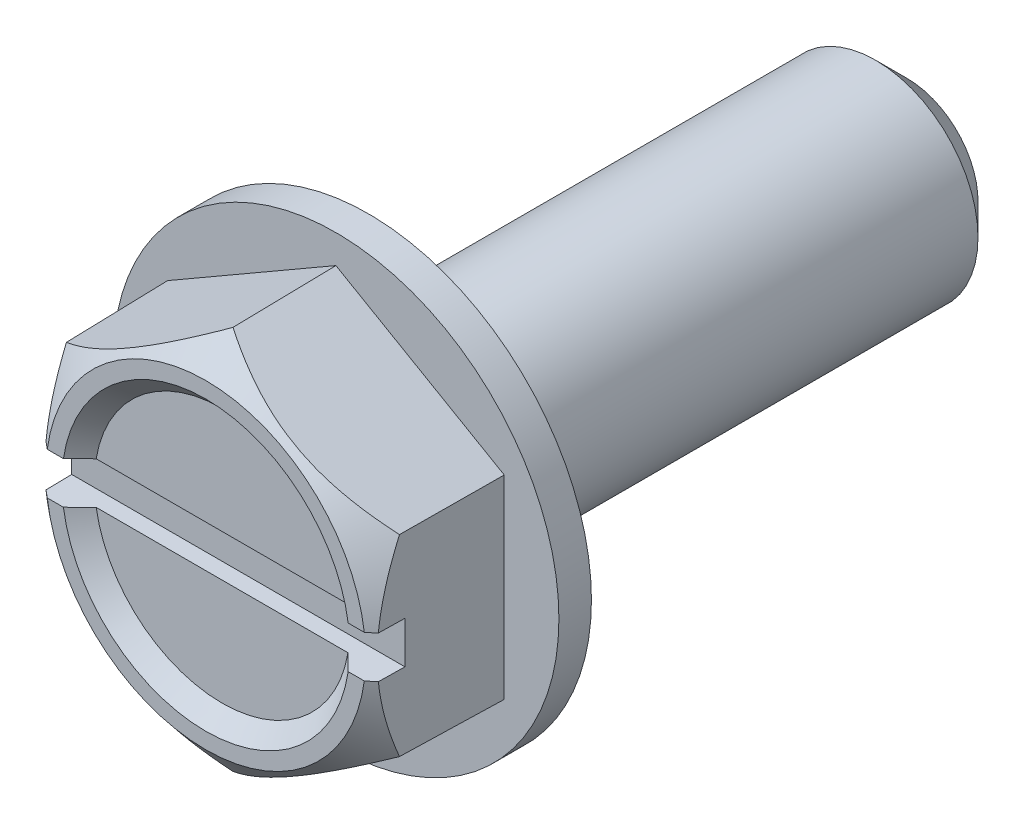
from build123d import *

# Parameters (mm, degrees)
SKETCH3_R           = 5.2578
BOSS_EXTRUDE1_DEPTH = 0.76708
BOSS_EXTRUDE2_DEPTH = 3.06832
BOSS_EXTRUDE2_TAPER = 1
SKETCH5_OUTSIDE_W   = 62.562
SKETCH5_OUTSIDE_H   = 62.562
SKETCH5_OUTSIDE_R   = 3.7703125
CUT_EXTRUDE1_DEPTH  = 19.130316457
CUT_EXTRUDE1_DRAFT  = -50
SKETCH6_R           = 3.39328125
CUT_EXTRUDE2_DEPTH  = 0.38354
CUT_EXTRUDE2_DRAFT  = -45
CUT_EXTRUDE3_START  = 3.8354
SKETCH10_W          = 8.334375
SKETCH10_H          = 0.9921875
CUT_EXTRUDE3_DEPTH  = 0.76708


with BuildPart() as part:
    # Sketch2 → Revolve1 (revolve)
    with BuildSketch(Plane(origin=(0, 0, 0), x_dir=(0, 0, -1), z_dir=(1, 0, 0))):
        Polygon((0, 0), (0, 2.413), (11.959166667, 2.413), (12.7, 1.672166667), (12.7, 0), align=None)
    revolve(axis=Axis((0, 0, -12.7), (0, 0, 1)))

    # Sketch3 → Boss-Extrude1 (add)
    with BuildSketch(Plane.XY):
        Circle(SKETCH3_R)
    extrude(amount=BOSS_EXTRUDE1_DEPTH)

    # Sketch4 → Boss-Extrude2 (add)
    with BuildSketch(Plane.XY.offset(0.76708)):
        Polygon((-3.96875, 2.291358881), (-3.96875, -2.291358881), (0, -4.582717762), (3.96875, -2.291358881), (3.96875, 2.291358881), (0, 4.582717762), align=None)
    extrude(amount=BOSS_EXTRUDE2_DEPTH, taper=BOSS_EXTRUDE2_TAPER)


with BuildPart() as cut_extrude1_tool:
    # Sketch5 outside → Cut-Extrude1 (with draft: the straight prism first)
    with BuildSketch(Plane.XY.offset(3.8354)):
        Rectangle(SKETCH5_OUTSIDE_W, SKETCH5_OUTSIDE_H)
        Circle(SKETCH5_OUTSIDE_R, mode=Mode.SUBTRACT)
    extrude(amount=-CUT_EXTRUDE1_DEPTH)
    # Cut-Extrude1: the draft: its side faces are tilted about the plane it starts from
    cut_extrude1_sides = [cut_extrude1_tool.faces().sort_by_distance(p)[0] for p in [
        (0, -31.281, -5.729758229),
        (31.281, 0, -5.729758229),
        (0, 31.281, -5.729758229),
        (-31.281, 0, -5.729758229),
        (-3.7703125, 0, -5.729758229),
    ]]
    draft(cut_extrude1_sides, Plane.XY.offset(3.8354), CUT_EXTRUDE1_DRAFT)


with BuildPart() as part_1:
    add(part.part)

    # Cut-Extrude1: cut by cut_extrude1_tool
    add(cut_extrude1_tool.part, mode=Mode.SUBTRACT)


with BuildPart() as cut_extrude2_tool:
    # Sketch6 → Cut-Extrude2 (with draft: the straight prism first)
    with BuildSketch(Plane.XY.offset(3.8354)):
        Circle(SKETCH6_R)
    extrude(amount=-CUT_EXTRUDE2_DEPTH)
    # Cut-Extrude2: the draft: its side faces are tilted about the plane it starts from
    cut_extrude2_sides = [cut_extrude2_tool.faces().sort_by_distance(p)[0] for p in [
        (-3.39328125, 0, 3.64363),
    ]]
    draft(cut_extrude2_sides, Plane.XY.offset(3.8354), CUT_EXTRUDE2_DRAFT)


with BuildPart() as part_2:
    add(part_1.part)

    # Cut-Extrude2: cut by cut_extrude2_tool
    add(cut_extrude2_tool.part, mode=Mode.SUBTRACT)

    # Sketch10 → Cut-Extrude3 (cut)
    with BuildSketch(Plane.XY.offset(CUT_EXTRUDE3_START)):
        Rectangle(SKETCH10_W, SKETCH10_H)
    extrude(amount=-CUT_EXTRUDE3_DEPTH, mode=Mode.SUBTRACT)


solid = part_2.part
